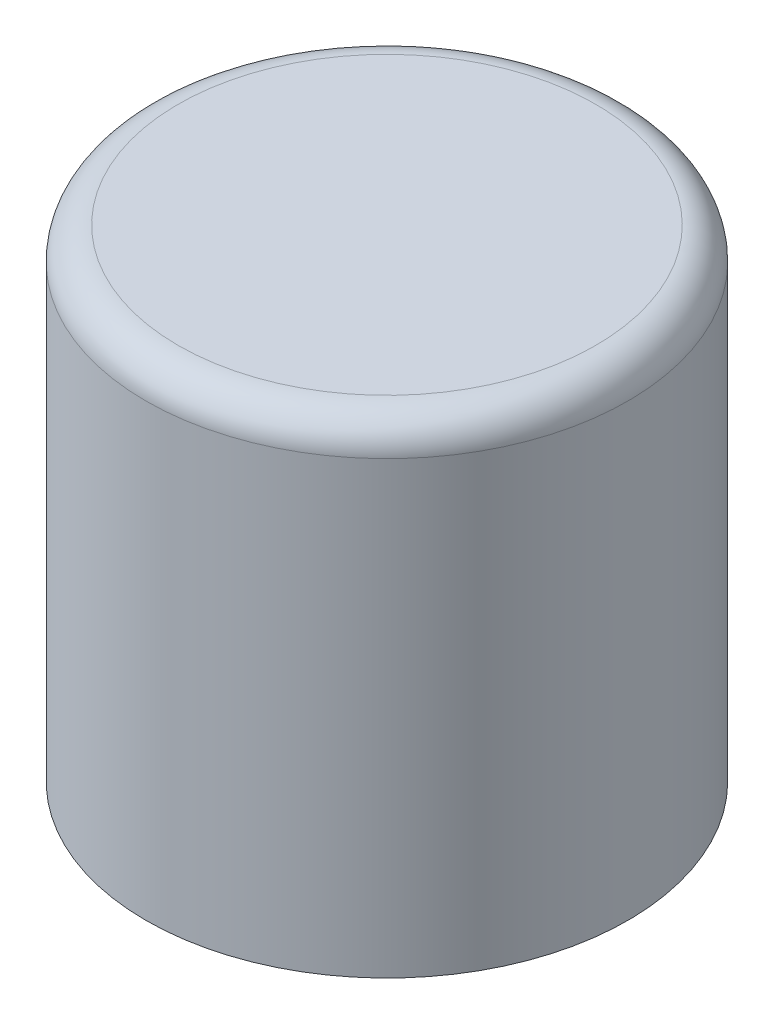
from build123d import *

# Parameters (mm, degrees)
SKETCH_1_R      = 15
EXTRUDE_1_DEPTH = 5
EXTRUDE_START   = -25
SKETCH_3_R      = 15
SKETCH_3_R_2    = 10
EXTRUDE_2_DEPTH = 25
FILLET_1_R      = 2


with BuildPart() as part:
    # 草图1 → 凸台-拉伸1 (new body)
    with BuildSketch(Plane(origin=(0, 0, 0), x_dir=(1, 0, 0), z_dir=(0, 1, 0))):
        with Locations(Location((0, 0, 0), (0, 0, 270))):
            Circle(SKETCH_1_R)
    extrude(amount=EXTRUDE_1_DEPTH)

    # 草图3 → 凸台-拉伸2 (add)
    with BuildSketch(Plane(origin=(0, 0, 0), x_dir=(1, 0, 0), z_dir=(0, 1, 0)).offset(EXTRUDE_START)):
        with Locations(Location((0, 0, 0), (0, 0, 270))):
            Circle(SKETCH_3_R)
        with Locations(Location((0, 0, 0), (0, 0, 270))):
            Circle(SKETCH_3_R_2, mode=Mode.SUBTRACT)
    extrude(amount=EXTRUDE_2_DEPTH)

    # 圆角1
    fillet_1_edges = [part.edges().sort_by_distance(p)[0] for p in [
        (0, 5, -15),
    ]]
    fillet(fillet_1_edges, radius=FILLET_1_R)


solid = part.part
